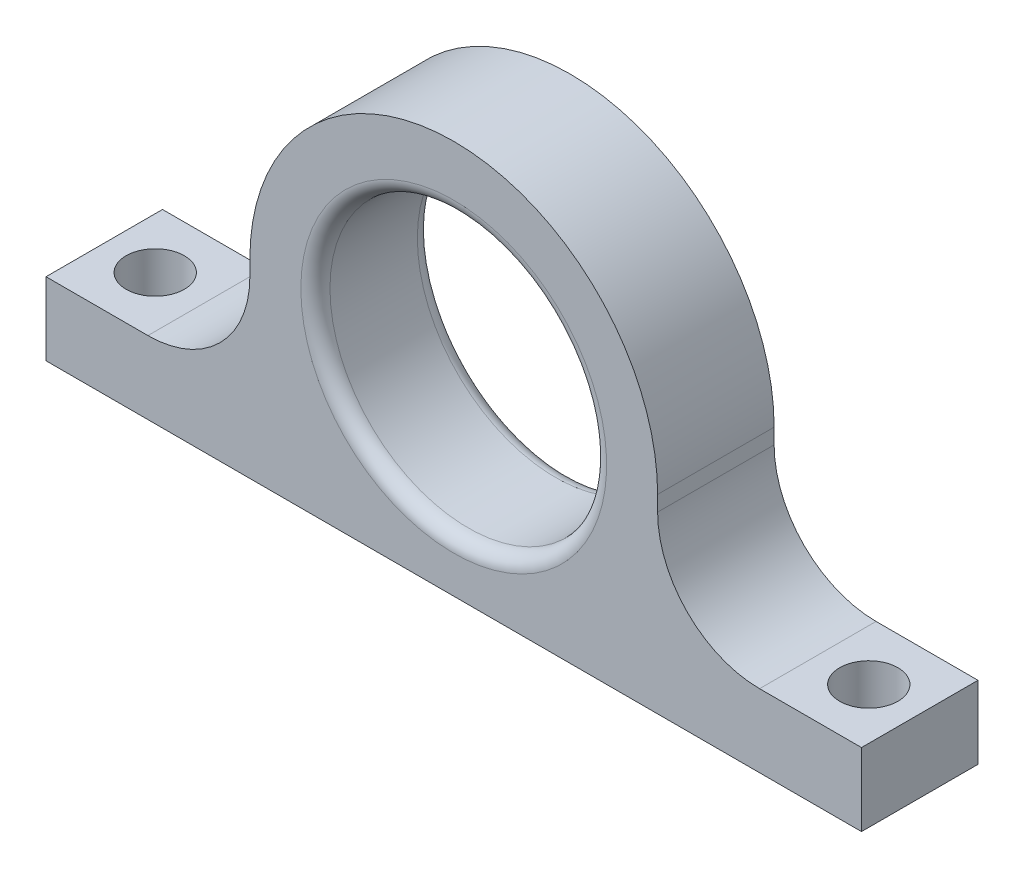
from build123d import *

# Parameters (mm, degrees)
ESQUISSE1_R             = 9.5
BOSS_EXTRU_1_DEPTH      = 8
CONG_1_R                = 1
CONG_2_R                = 1
CONG_3_R                = 7
ESQUISSE2_R             = 2
ENL_V_MAT_EXTRU_1_DEPTH = 6


with BuildPart() as part:
    # Esquisse1 → Boss.-Extru.1 (new body)
    with BuildSketch(Plane.XY):
        with BuildLine():
            Line((14, -8.053746339), (28, -8.053746339))
            Line((28, -8.053746339), (28, -13.053746339))
            Line((28, -13.053746339), (-28, -13.053746339))
            Line((-28, -13.053746339), (-28, -8.053746339))
            Line((-28, -8.053746339), (-14, -8.053746339))
            Line((-14, -8.053746339), (-14, 0))
            ThreePointArc((-14, 0), (0, 14), (14, 0))
            Line((14, 0), (14, -8.053746339))
        make_face()
        Circle(ESQUISSE1_R, mode=Mode.SUBTRACT)
    extrude(amount=BOSS_EXTRU_1_DEPTH)

    # Congé1
    cong_1_edges = [part.edges().sort_by_distance(p)[0] for p in [
        (-9.5, 0, 8),
    ]]
    fillet(cong_1_edges, radius=CONG_1_R)

    # Congé2
    cong_2_edges = [part.edges().sort_by_distance(p)[0] for p in [
        (-9.5, 0, 0),
    ]]
    fillet(cong_2_edges, radius=CONG_2_R)

    # Congé3
    cong_3_edges = [part.edges().sort_by_distance(p)[0] for p in [
        (-14, -8.053746339, 4),
        (14, -8.053746339, 4),
    ]]
    fillet(cong_3_edges, radius=CONG_3_R)

    # Esquisse2 → Enlèv. mat.-Extru.1 (cut)
    with BuildSketch(Plane(origin=(0, -8.053746339, 0), x_dir=(1, 0, 0), z_dir=(0, 1, 0))):
        with Locations(Location((24.5, -4, 0), (0, 0, 270))):
            Circle(ESQUISSE2_R)
        with Locations(Location((-24.5, -4, 0), (0, 0, 270))):
            Circle(ESQUISSE2_R)
    extrude(amount=-ENL_V_MAT_EXTRU_1_DEPTH, mode=Mode.SUBTRACT)


solid = part.part
